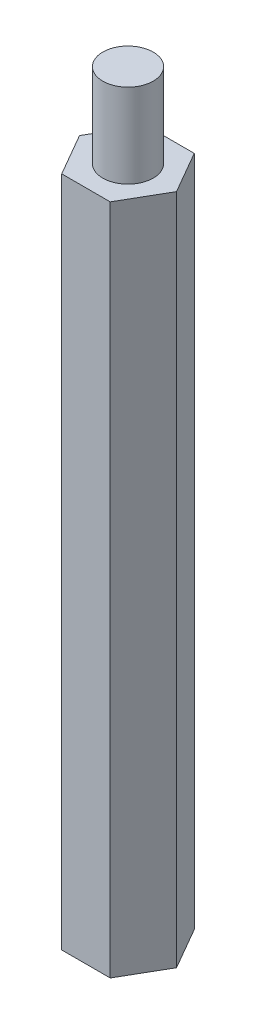
from build123d import *

# Parameters (mm, degrees)
EXTRUDE_1_DEPTH     = 40
SKETCH_2_R          = 1.5
EXTRUDE_2_DEPTH     = 5
SKETCH_3_R          = 1.5
CUT_EXTRUDE_1_DEPTH = 6


with BuildPart() as part:
    # 스케치1 → 보스-돌출1 (new body)
    with BuildSketch(Plane(origin=(0, 0, 0), x_dir=(1, 0, 0), z_dir=(0, 1, 0))):
        Polygon((-1.443375673, -2.5), (1.443375673, -2.5), (2.886751346, 0), (1.443375673, 2.5), (-1.443375673, 2.5), (-2.886751346, 0), align=None)
    extrude(amount=EXTRUDE_1_DEPTH)

    # 스케치2 → 보스-돌출2 (add)
    with BuildSketch(Plane(origin=(0, 40, 0), x_dir=(1, 0, 0), z_dir=(0, 1, 0))):
        with Locations(Location((0, 0, 0), (0, 0, 270))):
            Circle(SKETCH_2_R)
    extrude(amount=EXTRUDE_2_DEPTH)

    # 스케치3 → 컷-돌출1 (cut)
    with BuildSketch(Plane.XZ):
        with Locations(Location((0, 0, 0), (0, 0, 90))):
            Circle(SKETCH_3_R)
    extrude(amount=-CUT_EXTRUDE_1_DEPTH, mode=Mode.SUBTRACT)


solid = part.part
